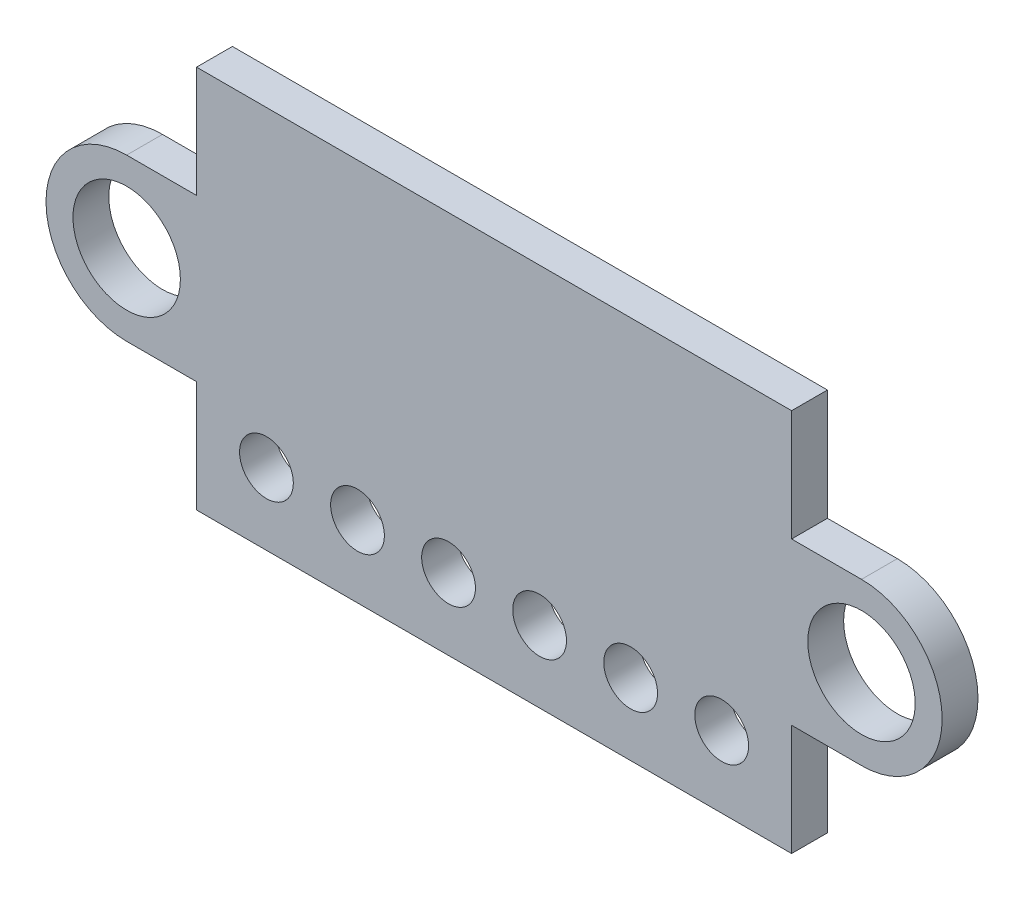
from build123d import *

# Parameters (mm, degrees)
SKETCH_1_R      = 1.498311188
SKETCH_1_R_2    = 0.75
EXTRUDE_1_DEPTH = 1
SKETCH_3_W      = 1.886758636
SKETCH_3_H      = 2.158643663
SKETCH_3_W_2    = 2.358039665
SKETCH_3_H_2    = 1.729620016
EXTRUDE_2_DEPTH = 1


with BuildPart() as part:
    # 草图1 → 凸台-拉伸1 (new body)
    with BuildSketch(Plane.XY):
        with BuildLine():
            Line((-10.25, 2.25), (-8.3, 2.25))
            Line((-8.3, 2.25), (-8.3, 5.35))
            Line((-8.3, 5.35), (8.3, 5.35))
            Line((8.3, 5.35), (8.3, 2.25))
            Line((8.3, 2.25), (10.25, 2.25))
            ThreePointArc((10.25, 2.25), (12.5, 0), (10.25, -2.25))
            Line((10.25, -2.25), (8.3, -2.25))
            Line((8.3, -2.25), (8.3, -5.35))
            Line((8.3, -5.35), (-8.3, -5.35))
            Line((-8.3, -5.35), (-8.3, -2.25))
            Line((-8.3, -2.25), (-10.25, -2.25))
            ThreePointArc((-10.25, -2.25), (-12.5, 0), (-10.25, 2.25))
        make_face()
        with Locations((-10.25, 0)):
            Circle(SKETCH_1_R, mode=Mode.SUBTRACT)
        with Locations(Location((10.25, 0, 0), (0, 0, 180))):
            Circle(SKETCH_1_R, mode=Mode.SUBTRACT)
        with Locations((-6.35, -3.35)):
            Circle(SKETCH_1_R_2, mode=Mode.SUBTRACT)
        with Locations((-3.81, -3.35)):
            Circle(SKETCH_1_R_2, mode=Mode.SUBTRACT)
        with Locations((-1.27, -3.35)):
            Circle(SKETCH_1_R_2, mode=Mode.SUBTRACT)
        with Locations((1.27, -3.35)):
            Circle(SKETCH_1_R_2, mode=Mode.SUBTRACT)
        with Locations((3.81, -3.35)):
            Circle(SKETCH_1_R_2, mode=Mode.SUBTRACT)
        with Locations((6.35, -3.35)):
            Circle(SKETCH_1_R_2, mode=Mode.SUBTRACT)
    extrude(amount=EXTRUDE_1_DEPTH)

    # 草图3 → 凸台-拉伸2 (add)
    with BuildSketch(Plane(origin=(0, 0, 0), x_dir=(-1, 0, 0), z_dir=(0, 0, -1))):
        with Locations((-0.28460322, 0.170508759)):
            Rectangle(SKETCH_3_W, SKETCH_3_H)
        with Locations((5.064207673, 1.540607703)):
            Rectangle(SKETCH_3_W_2, SKETCH_3_H_2)
    extrude(amount=EXTRUDE_2_DEPTH)


solid = part.part
